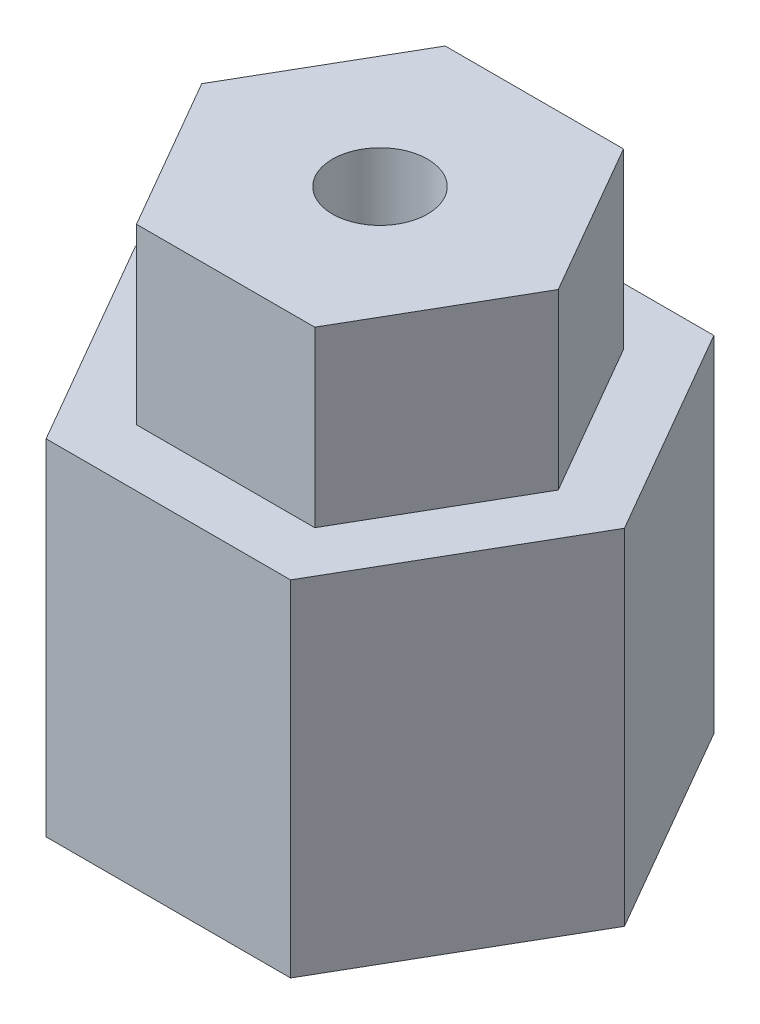
from build123d import *

# Parameters (mm, degrees)
SALIENTE_EXTRUIR1_DEPTH = 13.4
CROQUIS2_R              = 6.975
CORTAR_EXTRUIR1_DEPTH   = 2.75
CROQUIS3_R              = 1.85
CORTAR_EXTRUIR2_DEPTH   = 10.65
SALIENTE_EXTRUIR2_DEPTH = 6.75
CORTAR_EXTRUIR3_START   = -6.75
CROQUIS6_R              = 1.85
CORTAR_EXTRUIR3_DEPTH   = 6.75
CROQUIS7_R              = 2.65
CORTAR_EXTRUIR4_DEPTH   = 3.5


with BuildPart() as part:
    # Croquis1 → Saliente-Extruir1 (new body)
    with BuildSketch(Plane(origin=(0, 0, 0), x_dir=(1, 0, 0), z_dir=(0, 1, 0))):
        Polygon((9.5, 0), (4.75, 8.227241336), (-4.75, 8.227241336), (-9.5, 0), (-4.75, -8.227241336), (4.75, -8.227241336), align=None)
    extrude(amount=SALIENTE_EXTRUIR1_DEPTH)

    # Croquis2 → Cortar-Extruir1 (cut)
    with BuildSketch(Plane.XZ):
        with Locations(Location((0, 0, 0), (0, 0, 270))):
            Circle(CROQUIS2_R)
    extrude(amount=-CORTAR_EXTRUIR1_DEPTH, mode=Mode.SUBTRACT)

    # Croquis3 → Cortar-Extruir2 (cut)
    with BuildSketch(Plane.XZ.offset(-2.75)):
        with Locations(Location((0, 0, 0), (0, 0, 270))):
            Circle(CROQUIS3_R)
    extrude(amount=-CORTAR_EXTRUIR2_DEPTH, mode=Mode.SUBTRACT)

    # Croquis4 → Saliente-Extruir2 (add)
    with BuildSketch(Plane(origin=(0, 13.4, 0), x_dir=(1, 0, 0), z_dir=(0, 1, 0))):
        Polygon((6.92820323, 0), (3.464101615, 6), (-3.464101615, 6), (-6.92820323, 0), (-3.464101615, -6), (3.464101615, -6), align=None)
    extrude(amount=SALIENTE_EXTRUIR2_DEPTH)

    # Croquis6 → Cortar-Extruir3 (cut)
    with BuildSketch(Plane(origin=(0, 20.15, 0), x_dir=(1, 0, 0), z_dir=(0, 1, 0)).offset(CORTAR_EXTRUIR3_START)):
        with Locations(Location((0, 0, 0), (0, 0, 90))):
            Circle(CROQUIS6_R)
    extrude(amount=CORTAR_EXTRUIR3_DEPTH, mode=Mode.SUBTRACT)

    # Croquis7 → Cortar-Extruir4 (cut)
    with BuildSketch(Plane.XZ.offset(-2.75)):
        with Locations(Location((0, 0, 0), (0, 0, 270))):
            Circle(CROQUIS7_R)
    extrude(amount=-CORTAR_EXTRUIR4_DEPTH, mode=Mode.SUBTRACT)


solid = part.part
